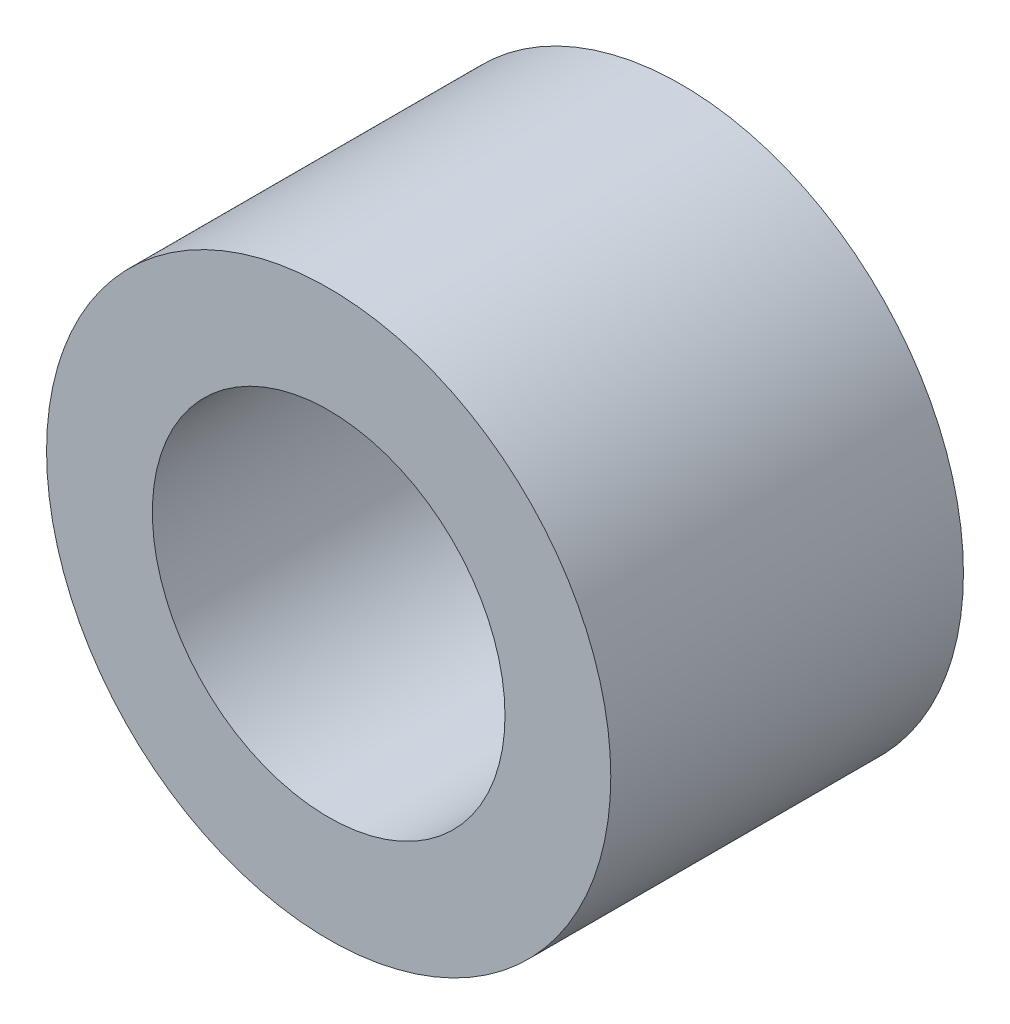
from build123d import *

# Parameters (mm, degrees)
ESQUISSE1_R             = 4
BOSS_EXTRU_1_DEPTH      = 5
ESQUISSE2_R             = 2.5
ENL_V_MAT_EXTRU_1_DEPTH = 8.549834435


with BuildPart() as part:
    # Esquisse1 → Boss.-Extru.1 (new body)
    with BuildSketch(Plane.XY):
        Circle(ESQUISSE1_R)
    extrude(amount=BOSS_EXTRU_1_DEPTH)

    # Esquisse2 → Enlèv. mat.-Extru.1 (cut, through all)
    with BuildSketch(Plane.XY.offset(5)):
        Circle(ESQUISSE2_R)
    extrude(amount=-ENL_V_MAT_EXTRU_1_DEPTH, mode=Mode.SUBTRACT)


solid = part.part
